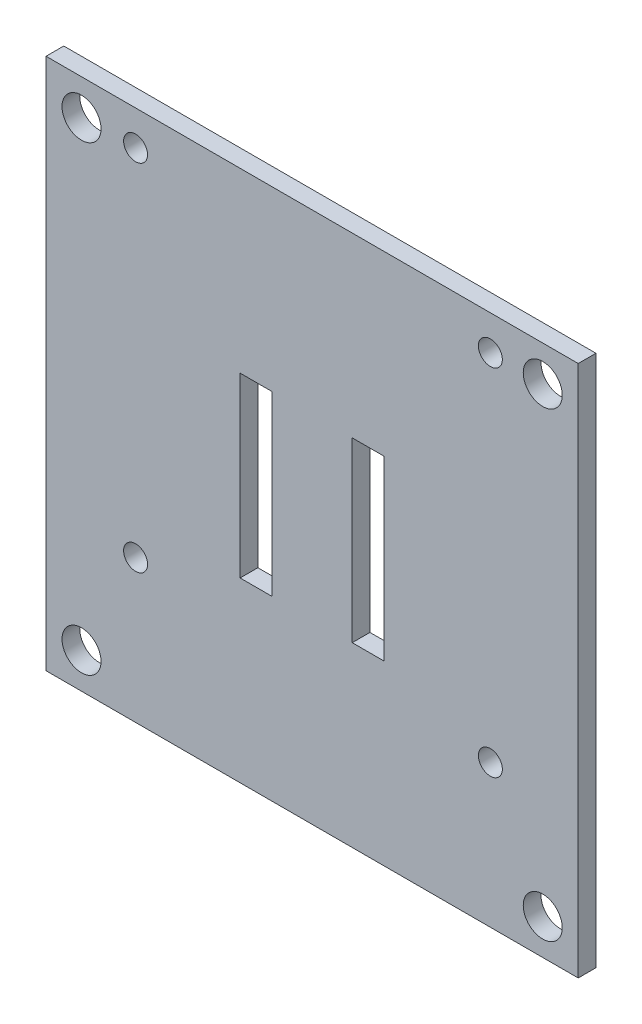
from build123d import *

# Parameters (mm, degrees)
SKETCH2_W           = 76.2
SKETCH2_H           = 76.2
BOSS_EXTRUDE1_DEPTH = 2.54
SKETCH7_R           = 1.7145
CUT_EXTRUDE1_DEPTH  = 5.08
SKETCH9_W           = 4.572
SKETCH9_H           = 25.4
CUT_EXTRUDE2_DEPTH  = 5.08
SKETCH6_R           = 2.794
CUT_EXTRUDE3_DEPTH  = 5.08


with BuildPart() as part:
    # Sketch2 → Boss-Extrude1 (new body)
    with BuildSketch(Plane.XY):
        Rectangle(SKETCH2_W, SKETCH2_H)
    extrude(amount=BOSS_EXTRUDE1_DEPTH)

    # Sketch7 → Cut-Extrude1 (cut)
    with BuildSketch(Plane(origin=(0, 0, 0), x_dir=(-1, 0, 0), z_dir=(0, 0, -1))):
        with Locations((25.278322628, -17.651318113)):
            Circle(SKETCH7_R)
        with Locations((25.278322628, 33.148681887)):
            Circle(SKETCH7_R)
        with Locations((-25.521677372, 33.148681887)):
            Circle(SKETCH7_R)
        with Locations((-25.521677372, -17.651318113)):
            Circle(SKETCH7_R)
    extrude(amount=-CUT_EXTRUDE1_DEPTH, mode=Mode.SUBTRACT)

    # Sketch9 → Cut-Extrude2 (cut)
    with BuildSketch(Plane.XY.offset(2.54)):
        with Locations((8.023665405, 0)):
            Rectangle(SKETCH9_W, SKETCH9_H)
        with Locations((-8.023665405, 0)):
            Rectangle(SKETCH9_W, SKETCH9_H)
    extrude(amount=-CUT_EXTRUDE2_DEPTH, mode=Mode.SUBTRACT)

    # Sketch6 → Cut-Extrude3 (cut)
    with BuildSketch(Plane(origin=(0, 0, 0), x_dir=(-1, 0, 0), z_dir=(0, 0, -1))):
        with Locations((33.02, 33.02)):
            Circle(SKETCH6_R)
        with Locations((-33.02, 33.02)):
            Circle(SKETCH6_R)
        with Locations((-33.02, -33.02)):
            Circle(SKETCH6_R)
        with Locations((33.02, -33.02)):
            Circle(SKETCH6_R)
    extrude(amount=-CUT_EXTRUDE3_DEPTH, mode=Mode.SUBTRACT)


solid = part.part
